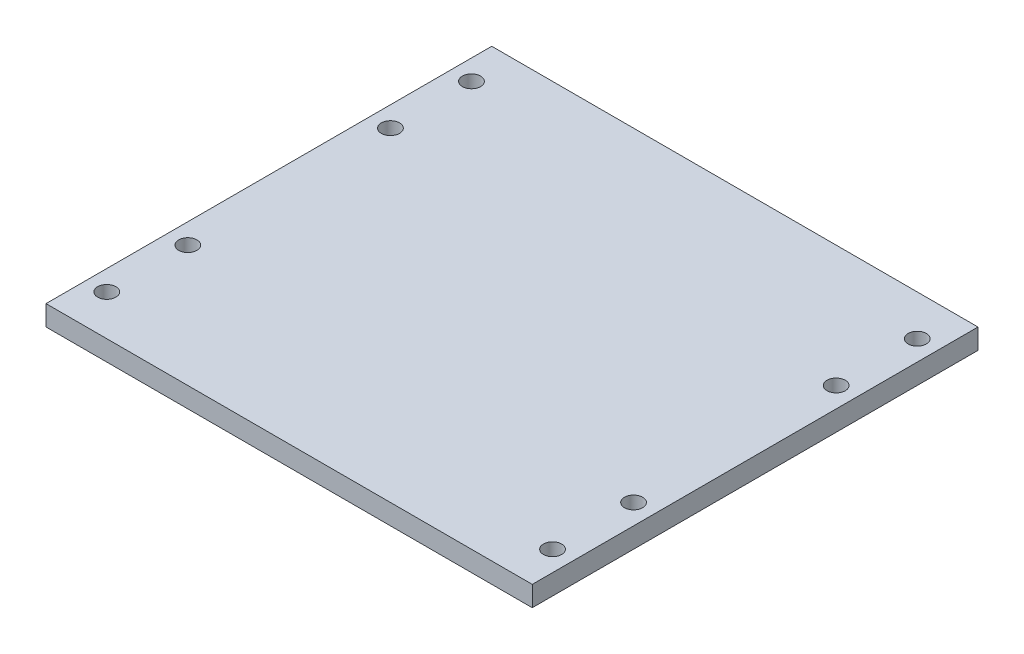
from build123d import *

# Parameters (mm, degrees)
SKETCH1_W                  = 120
SKETCH1_H                  = 110
BOSS_EXTRUDE1_DEPTH        = 5
F_4_5_4_5_DIAMETER_HOLE1_D = 4.5


with BuildPart() as part:
    # Sketch1 → Boss-Extrude1 (new body)
    with BuildSketch(Plane(origin=(0, 0, 0), x_dir=(1, 0, 0), z_dir=(0, 1, 0))):
        Rectangle(SKETCH1_W, SKETCH1_H)
    extrude(amount=BOSS_EXTRUDE1_DEPTH)

    # Ø4.5 (4.5) Diameter Hole1 (through all)
    with Locations(Plane(origin=(0, 5, 0), x_dir=(1, 0, 0), z_dir=(0, 1, 0))):
        with Locations((-55, 45), (-55, 25), (-55, -25), (-55, -45), (55, -45), (55, -25), (55, 25), (55, 45)):
            Hole(F_4_5_4_5_DIAMETER_HOLE1_D / 2)


solid = part.part
